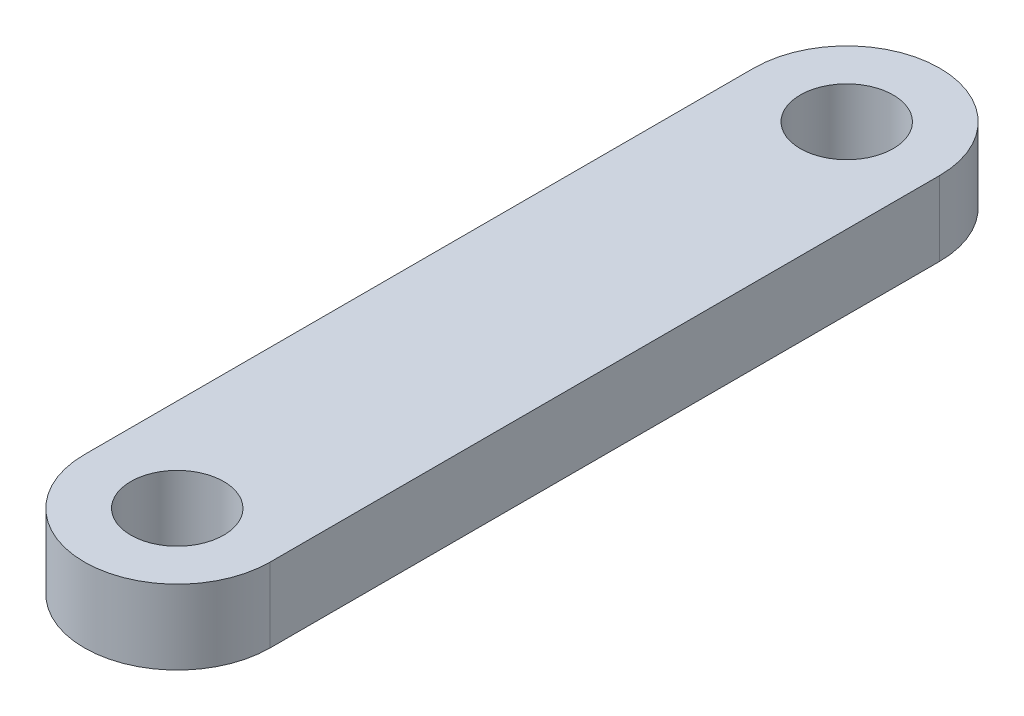
from build123d import *

# Parameters (mm, degrees)
SKETCH1_R           = 1
BOSS_EXTRUDE1_DEPTH = 2
MOVE_FACE1_BY       = 0.25
MOVE_FACE1_2_BY     = 0.25


with BuildPart() as part:
    # Sketch1 → Boss-Extrude1 (new body)
    with BuildSketch(Plane(origin=(0, 0, 0), x_dir=(1, 0, 0), z_dir=(0, 1, 0))):
        with BuildLine():
            Line((-2.5, 0), (-2.5, 18))
            ThreePointArc((-2.5, 18), (0, 20.5), (2.5, 18))
            Line((2.5, 18), (2.5, 0))
            ThreePointArc((2.5, 0), (0, -2.5), (-2.5, 0))
        make_face()
        with Locations(Location((0, 18, 0), (0, 0, 270))):
            Circle(SKETCH1_R, mode=Mode.SUBTRACT)
        with Locations(Location((0, 0, 0), (0, 0, 270))):
            Circle(SKETCH1_R, mode=Mode.SUBTRACT)
    extrude(amount=BOSS_EXTRUDE1_DEPTH)

    # Move Face1: a curved face moved inward by 0.25
    add(Solid.thicken(part.faces().sort_by_distance((0, 1, -1))[0], -MOVE_FACE1_BY), mode=Mode.SUBTRACT)

    # Move Face1 2: a curved face moved inward by 0.25
    add(Solid.thicken(part.faces().sort_by_distance((0, 1, -19))[0], -MOVE_FACE1_2_BY), mode=Mode.SUBTRACT)


solid = part.part
